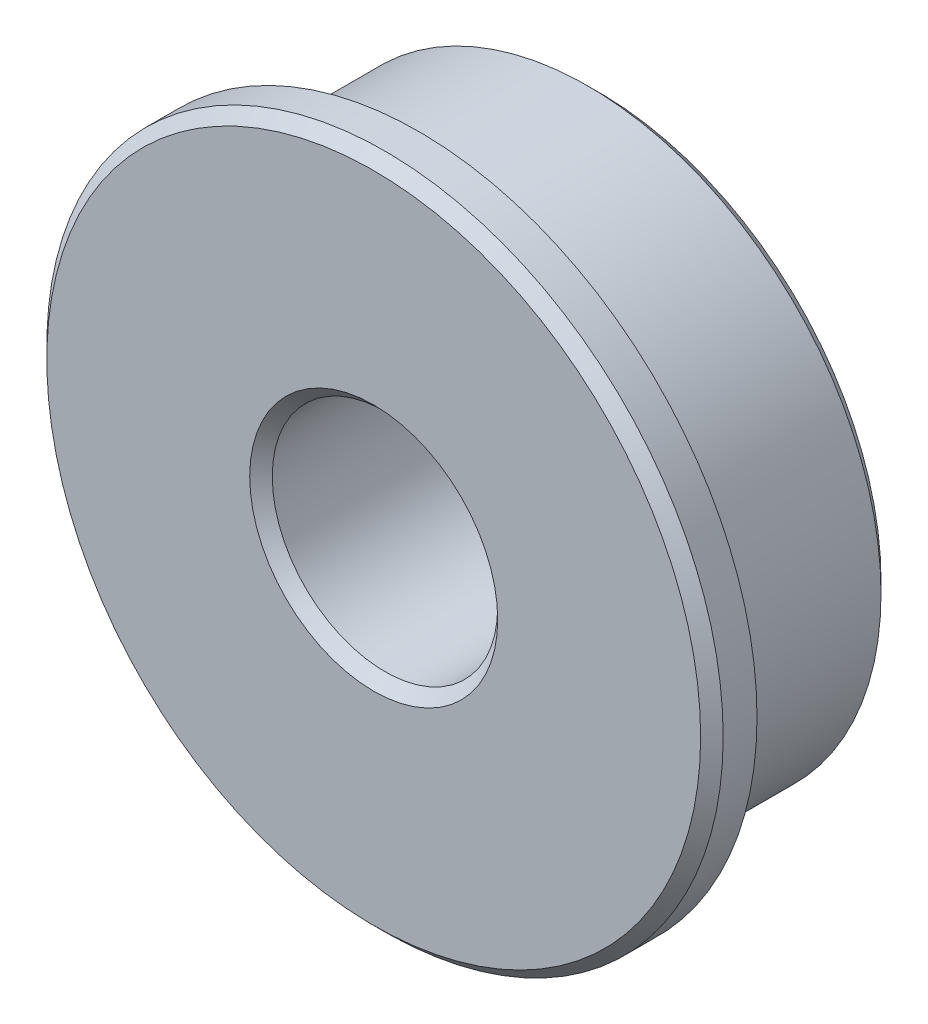
from build123d import *

# Parameters (mm, degrees)
ESQUISSE1_R        = 6.5
ESQUISSE1_R_2      = 2.5
BOSS_EXTRU_1_DEPTH = 5
ESQUISSE2_R        = 7.5
ESQUISSE2_R_2      = 3
BOSS_EXTRU_2_DEPTH = 1
CHANFREIN1_SIZE    = 0.25


with BuildPart() as part:
    # Esquisse1 → Boss.-Extru.1 (new body)
    with BuildSketch(Plane.XY):
        Circle(ESQUISSE1_R)
        Circle(ESQUISSE1_R_2, mode=Mode.SUBTRACT)
    extrude(amount=BOSS_EXTRU_1_DEPTH)

    # Esquisse2 → Boss.-Extru.2 (add)
    with BuildSketch(Plane.XY.offset(5)):
        Circle(ESQUISSE2_R)
        Circle(ESQUISSE2_R_2, mode=Mode.SUBTRACT)
    extrude(amount=-BOSS_EXTRU_2_DEPTH)

    # Chanfrein1
    chanfrein1_edges = [part.edges().sort_by_distance(p)[0] for p in [
        (-7.5, 0, 5),
        (-6.5, 0, 0),
        (-2.5, 0, 5),
    ]]
    chamfer(chanfrein1_edges, length=CHANFREIN1_SIZE)


solid = part.part
